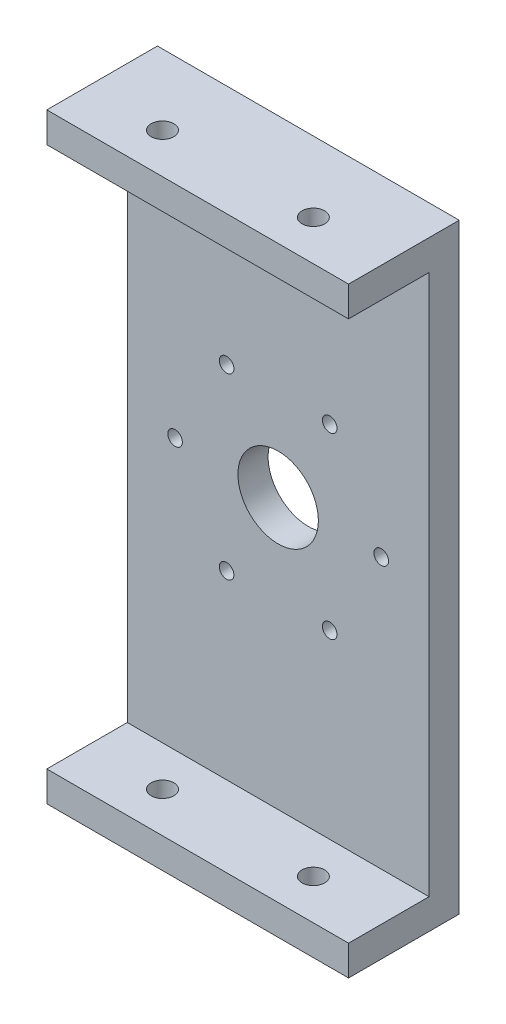
from build123d import *

# Parameters (mm, degrees)
REPISA_START                   = 373
SK_REPISA_W                    = 60
SK_REPISA_H                    = 119.5
REPISA_DEPTH                   = 6
CENTRO_MOTOR_START             = 373
SK_CENTRO_MOTOR_R              = 8
CENTRO_MOTOR_DEPTH             = 6
PASANTES_M2_5_ESTATOR_J4_START = 373
SK_PASANTES_M2_5_ESTATOR_J4_R  = 1.45
PASANTES_M2_5_ESTATOR_J4_DEPTH = 6
PESTANAS_START                 = 379
SK_PESTANAS_W                  = 60
SK_PESTANAS_H                  = 6
PESTANAS_DEPTH                 = 16
PASANTES_M4_PESTANAS_START     = -59.75
SK_PASANTES_M4_PESTANAS_R      = 2.25
PASANTES_M4_PESTANAS_DEPTH     = 119.5


with BuildPart() as part:
    # Sk_Repisa → Repisa (new body)
    with BuildSketch(Plane.XY.offset(REPISA_START)):
        Rectangle(SK_REPISA_W, SK_REPISA_H)
    extrude(amount=REPISA_DEPTH)

    # Sk_Centro_motor → Centro_motor (cut)
    with BuildSketch(Plane.XY.offset(CENTRO_MOTOR_START)):
        Circle(SK_CENTRO_MOTOR_R)
    extrude(amount=CENTRO_MOTOR_DEPTH, mode=Mode.SUBTRACT)

    # Sk_Pasantes_M2-5_estator_J4 → Pasantes_M2-5_estator_J4 (cut)
    with BuildSketch(Plane.XY.offset(PASANTES_M2_5_ESTATOR_J4_START)):
        with Locations((20.5, 0)):
            Circle(SK_PASANTES_M2_5_ESTATOR_J4_R)
        with Locations((10.25, 17.753520778)):
            Circle(SK_PASANTES_M2_5_ESTATOR_J4_R)
        with Locations((-10.25, 17.753520778)):
            Circle(SK_PASANTES_M2_5_ESTATOR_J4_R)
        with Locations((-20.5, 0)):
            Circle(SK_PASANTES_M2_5_ESTATOR_J4_R)
        with Locations((-10.25, -17.753520778)):
            Circle(SK_PASANTES_M2_5_ESTATOR_J4_R)
        with Locations((10.25, -17.753520778)):
            Circle(SK_PASANTES_M2_5_ESTATOR_J4_R)
    extrude(amount=PASANTES_M2_5_ESTATOR_J4_DEPTH, mode=Mode.SUBTRACT)

    # Sk_Pestanas → Pestanas (add)
    with BuildSketch(Plane.XY.offset(PESTANAS_START)):
        with Locations((0, 56.75)):
            Rectangle(SK_PESTANAS_W, SK_PESTANAS_H)
        with Locations((0, -56.75)):
            Rectangle(SK_PESTANAS_W, SK_PESTANAS_H)
    extrude(amount=PESTANAS_DEPTH)

    # Sk_Pasantes_M4_pestanas → Pasantes_M4_pestanas (cut)
    with BuildSketch(Plane(origin=(0, 0, 0), x_dir=(1, 0, 0), z_dir=(0, 1, 0)).offset(PASANTES_M4_PESTANAS_START)):
        with Locations(Location((-15, -387, 0), (0, 0, 270))):
            Circle(SK_PASANTES_M4_PESTANAS_R)
        with Locations(Location((15, -387, 0), (0, 0, 270))):
            Circle(SK_PASANTES_M4_PESTANAS_R)
    extrude(amount=PASANTES_M4_PESTANAS_DEPTH, mode=Mode.SUBTRACT)


solid = part.part
